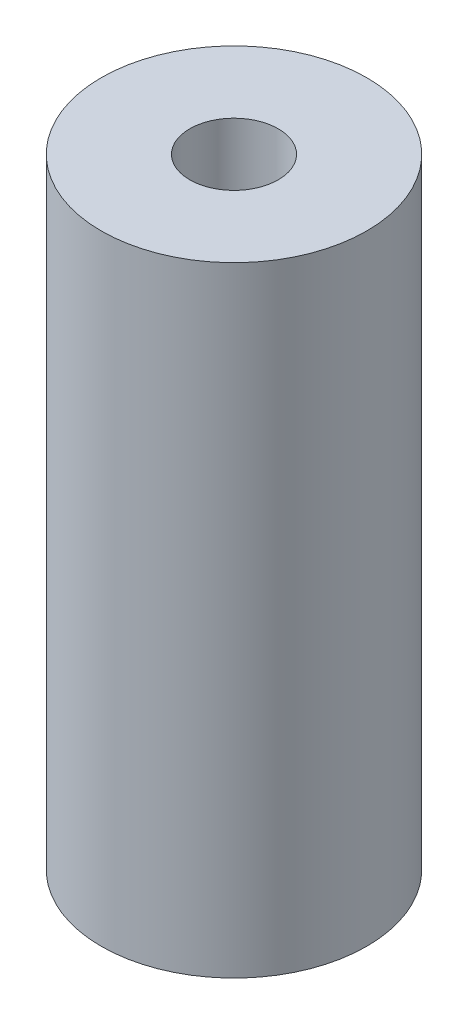
from build123d import *

# Parameters (mm, degrees)
SKETCH2_R           = 3
SKETCH2_R_2         = 1
BOSS_EXTRUDE1_DEPTH = 14


with BuildPart() as part:
    # Sketch2 → Boss-Extrude1 (new body)
    with BuildSketch(Plane(origin=(0, 0, 0), x_dir=(1, 0, 0), z_dir=(0, 1, 0))):
        with Locations(Location((0, 0, 0), (0, 0, 270))):
            Circle(SKETCH2_R)
        with Locations(Location((0, 0, 0), (0, 0, 270))):
            Circle(SKETCH2_R_2, mode=Mode.SUBTRACT)
    extrude(amount=BOSS_EXTRUDE1_DEPTH)


solid = part.part
